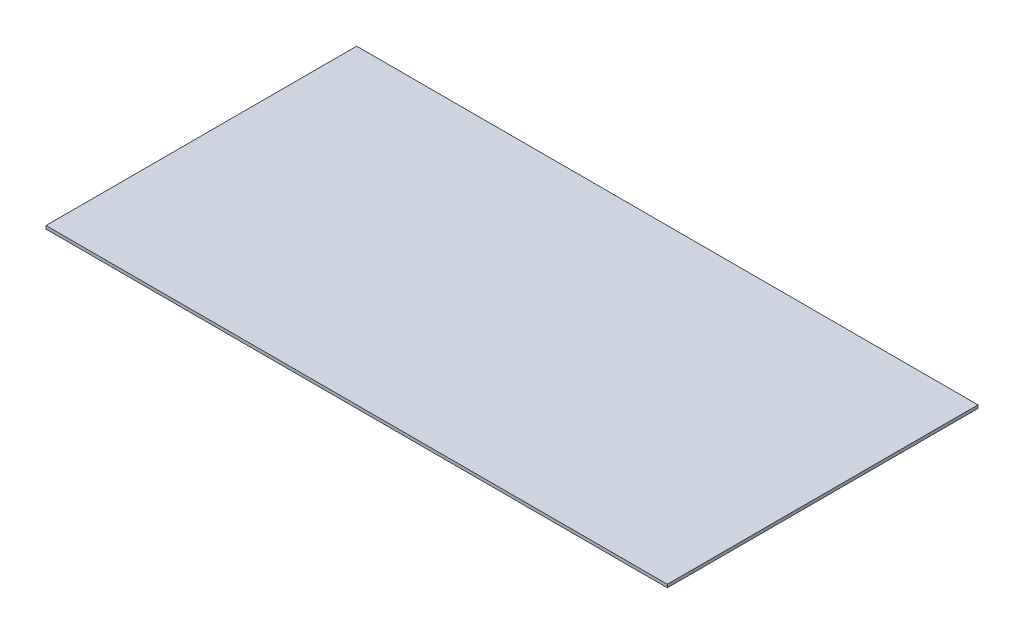
from build123d import *

# Parameters (mm, degrees)
SKETCH1_W           = 20000
SKETCH1_H           = 10000
BOSS_EXTRUDE1_DEPTH = 100


with BuildPart() as part:
    # Sketch1 → Boss-Extrude1 (new body)
    with BuildSketch(Plane(origin=(0, 0, 0), x_dir=(1, 0, 0), z_dir=(0, 1, 0))):
        Rectangle(SKETCH1_W, SKETCH1_H)
    extrude(amount=BOSS_EXTRUDE1_DEPTH)


solid = part.part
